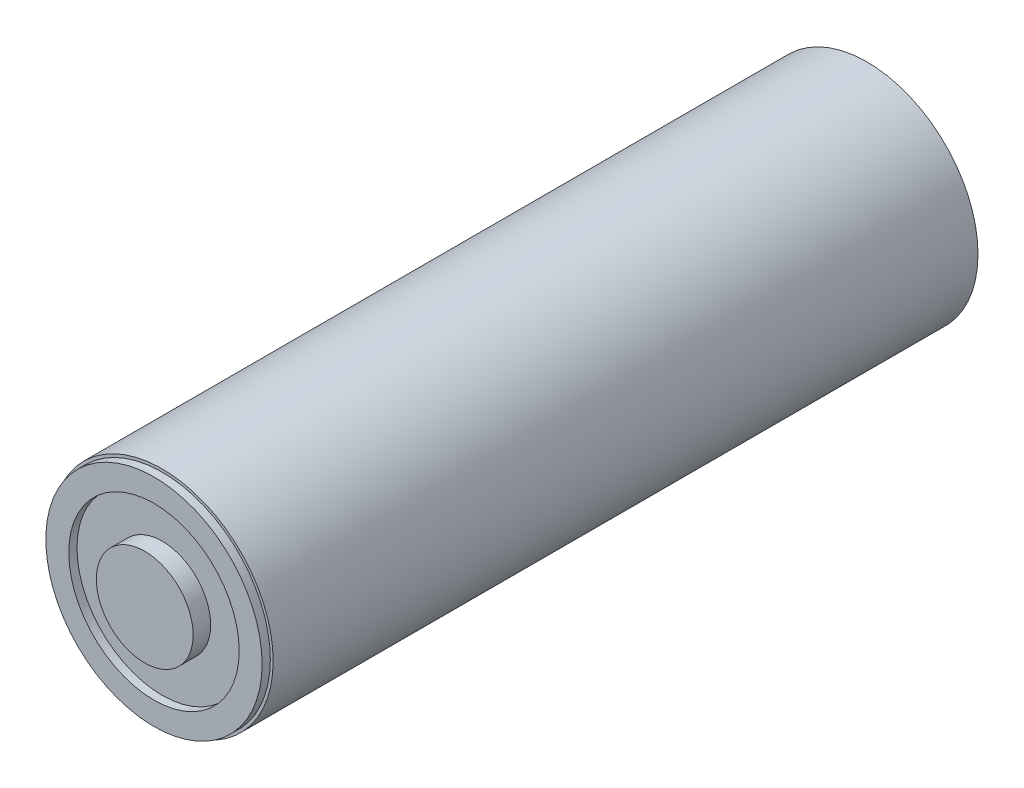
from build123d import *

# Parameters (mm, degrees)
SKETCH1_R           = 10.775
BOSS_EXTRUDE1_DEPTH = 68.45
SKETCH2_R           = 4.7
BOSS_EXTRUDE2_DEPTH = 1.7
SKETCH3_R           = 10.5
SKETCH3_R_2         = 8.275
BOSS_EXTRUDE3_DEPTH = 0.8


with BuildPart() as part:
    # Sketch1 → Boss-Extrude1 (new body)
    with BuildSketch(Plane.XY):
        Circle(SKETCH1_R)
    extrude(amount=BOSS_EXTRUDE1_DEPTH)

    # Sketch2 → Boss-Extrude2 (add)
    with BuildSketch(Plane.XY.offset(68.45)):
        Circle(SKETCH2_R)
    extrude(amount=BOSS_EXTRUDE2_DEPTH)

    # Sketch3 → Boss-Extrude3 (add)
    with BuildSketch(Plane.XY.offset(68.45)):
        Circle(SKETCH3_R)
        Circle(SKETCH3_R_2, mode=Mode.SUBTRACT)
    extrude(amount=BOSS_EXTRUDE3_DEPTH)


solid = part.part
